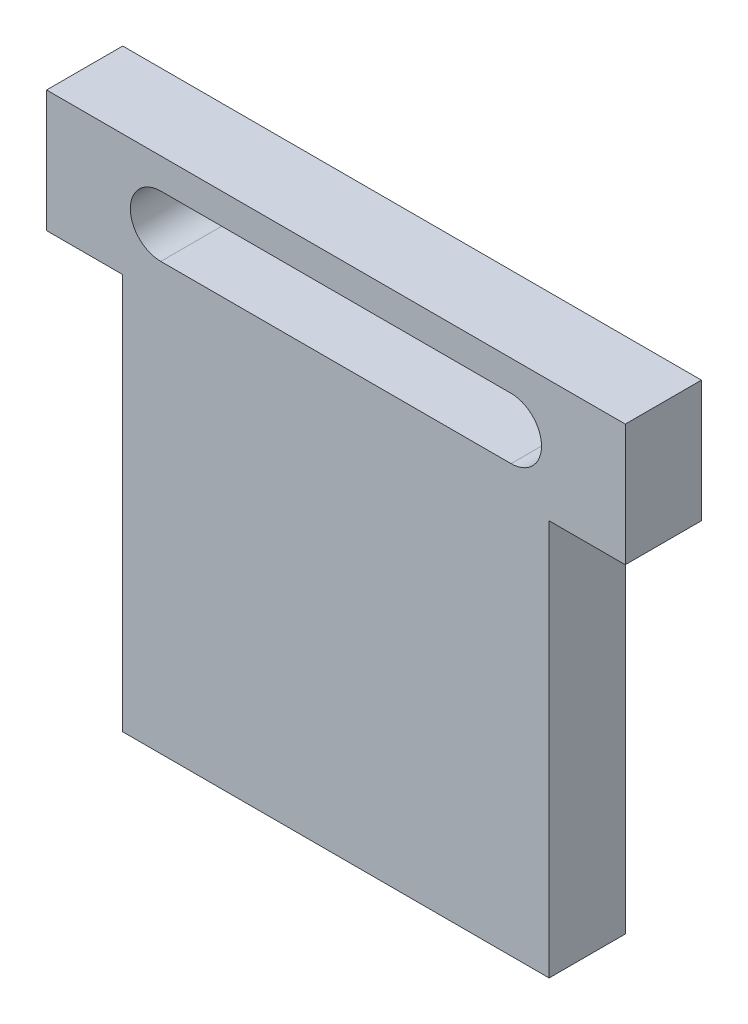
from build123d import *

# Parameters (mm, degrees)
CORPS_VERROU_GUILLOTINE_START         = -4.5
CORPS_VERROU_GUILLOTINE_DEPTH         = 5
LUMIERE_OBLONGUE_MANIVELLE_DEPTH      = 43.231504828
LUMIERE_OBLONGUE_MANIVELLE_DEPTH_BACK = 43.231504828


with BuildPart() as part:
    # Esquisse1 → Corps_verrou_guillotine (new body)
    with BuildSketch(Plane.XY.offset(CORPS_VERROU_GUILLOTINE_START)):
        Polygon((-19, 36.5), (19, 36.5), (19, 28.5), (14, 28.5), (14, 2.5), (-14, 2.5), (-14, 28.5), (-19, 28.5), align=None)
    extrude(amount=-CORPS_VERROU_GUILLOTINE_DEPTH)

    # Esquisse2 → Lumiere_oblongue_manivelle (cut, two sides: drawn at the far end of the back side and taken through both)
    with BuildSketch(Plane.XY.offset(-LUMIERE_OBLONGUE_MANIVELLE_DEPTH_BACK)):
        with BuildLine():
            Line((-11.5, 34.5), (11.5, 34.5))
            ThreePointArc((11.5, 34.5), (13.5, 32.5), (11.5, 30.5))
            Line((11.5, 30.5), (-11.5, 30.5))
            ThreePointArc((-11.5, 30.5), (-13.5, 32.5), (-11.5, 34.5))
        make_face()
    extrude(amount=LUMIERE_OBLONGUE_MANIVELLE_DEPTH + LUMIERE_OBLONGUE_MANIVELLE_DEPTH_BACK, mode=Mode.SUBTRACT)


solid = part.part
